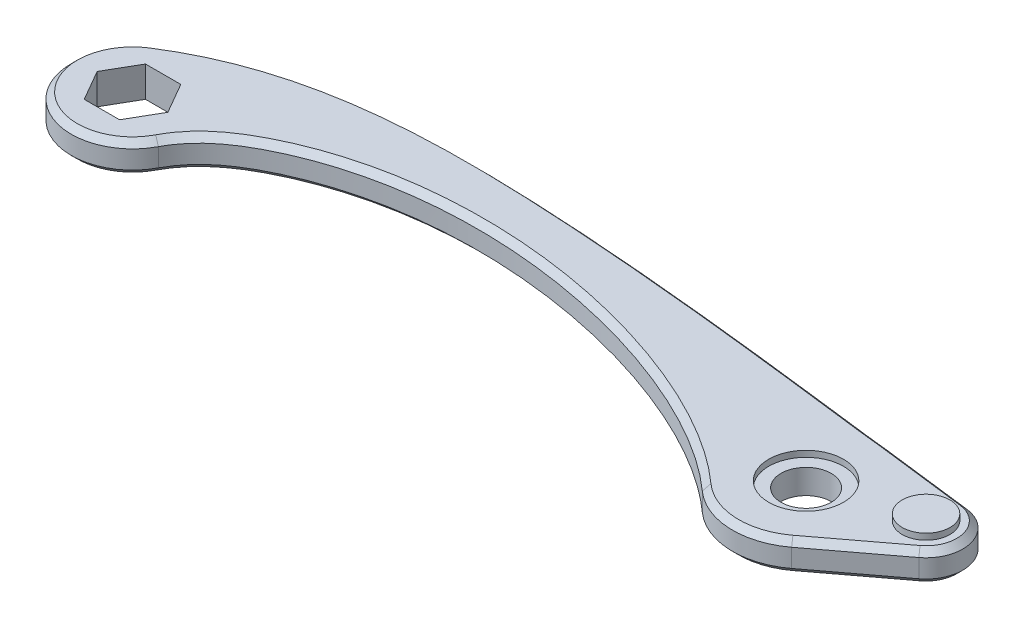
from build123d import *

# Parameters (mm, degrees)
EXTRUDE_1_DEPTH     = 10
SKETCH_2_R          = 8.2
CUT_EXTRUDE_1_DEPTH = 10
SKETCH_3_R          = 7.8
EXTRUDE_2_DEPTH     = 2
CUT_EXTRUDE_2_DEPTH = 244.001178821
CHAMFER_1_SIZE      = 2
SKETCH_12_R         = 12.2
CUT_EXTRUDE_3_DEPTH = 2


with BuildPart() as part:
    # 草图1 → 凸台-拉伸1 (new body)
    with BuildSketch(Plane(origin=(0, 0, 0), x_dir=(1, 0, 0), z_dir=(0, 1, 0))):
        with BuildLine():
            ThreePointArc((38.135472776, -1.298351331), (42.500736357, 11.388037985), (32.377112543, 20.192141624))
            Line((32.377112543, 20.192141624), (2.934972204, 23.819864361))
            ThreePointArc((2.934972204, 23.819864361), (2.523648479, 23.866947822), (2.111573774, 23.906929042))
            add(Edge.make_bspline(
                [(2.111573774, 23.906929042), (-9.810921984, 24.95998062), (-117.579356421, 40.552472419), (-200.501701748, 36.233495272), (-230.78473121, 16.843086794)],
                knots=[0, 0, 0, 0, 0.545538067, 1, 1, 1, 1], degree=3))
            ThreePointArc((-230.78473121, 16.843086794), (-233.515274748, -14.74236577), (-202.285423784, -9.284061046))
            add(Edge.make_bspline(
                [(-16.047074382, -17.846327459), (-50.225325952, 12.886098942), (-142.28144772, 36.786073578), (-197.939957095, -0.992635508), (-202.285423784, -9.284061046)],
                knots=[0, 0, 0, 0, 0.861614938, 1, 1, 1, 1], degree=3))
            ThreePointArc((-16.047074382, -17.846327459), (-8.21278774, -22.551055797), (0.812217897, -23.986252356))
            ThreePointArc((0.812217897, -23.986252356), (8.004199727, -22.625931732), (14.451692669, -19.161121549))
            Line((14.451692669, -19.161121549), (38.135472776, -1.298351331))
        make_face()
    extrude(amount=EXTRUDE_1_DEPTH)

    # 草图2 → 切除-拉伸1 (cut)
    with BuildSketch(Plane(origin=(0, 10, 0), x_dir=(1, 0, 0), z_dir=(0, 1, 0))):
        with Locations(Location((0, 0, 0), (0, 0, 270))):
            Circle(SKETCH_2_R)
    extrude(amount=-CUT_EXTRUDE_1_DEPTH, mode=Mode.SUBTRACT)

    # 草图3 → 凸台-拉伸2 (add)
    with BuildSketch(Plane(origin=(0, 10, 0), x_dir=(1, 0, 0), z_dir=(0, 1, 0))):
        with Locations(Location((30.909626441, 8.282209443, 0), (0, 0, 270))):
            Circle(SKETCH_3_R)
    extrude(amount=EXTRUDE_2_DEPTH)

    # 草图6 → 切除-拉伸2 (cut, through all)
    with BuildSketch(Plane(origin=(0, 10, 0), x_dir=(1, 0, 0), z_dir=(0, 1, 0))):
        Polygon((-208.452994616, 0), (-214.226497308, 10), (-225.773502692, 10), (-231.547005384, 0), (-225.773502692, -10), (-214.226497308, -10), align=None)
    extrude(amount=-CUT_EXTRUDE_2_DEPTH, mode=Mode.SUBTRACT)

    # 倒角1
    chamfer_1_edges = [part.edges().sort_by_distance(p)[0] for p in [
        (-109.293214932, 0, -18.683029708),
        (2.523648479, 0, -23.866947822),
        (-233.515274748, 0, 14.74236577),
        (17.656042374, 0, -22.006002992),
        (-109.293214932, 0, -18.683029708),
        (42.500736357, 0, -11.388037985),
        (-1.033673825, 0, 23.977729634),
        (26.293582722, 0, 10.22973644),
        (-109.293214932, 10, -18.683029708),
        (2.523648479, 10, -23.866947822),
        (-233.515274748, 10, 14.74236577),
        (17.656042374, 10, -22.006002992),
        (-109.293214932, 10, -18.683029708),
        (42.500736357, 10, -11.388037985),
        (-1.033673825, 10, 23.977729634),
        (26.293582722, 10, 10.22973644),
    ]]
    chamfer(chamfer_1_edges, length=CHAMFER_1_SIZE)

    # 草图12 → 切除-拉伸3 (cut)
    with BuildSketch(Plane(origin=(0, 10, 0), x_dir=(1, 0, 0), z_dir=(0, 1, 0))):
        with Locations(Location((0, 0, 0), (0, 0, 270))):
            Circle(SKETCH_12_R)
    extrude(amount=-CUT_EXTRUDE_3_DEPTH, mode=Mode.SUBTRACT)


solid = part.part
